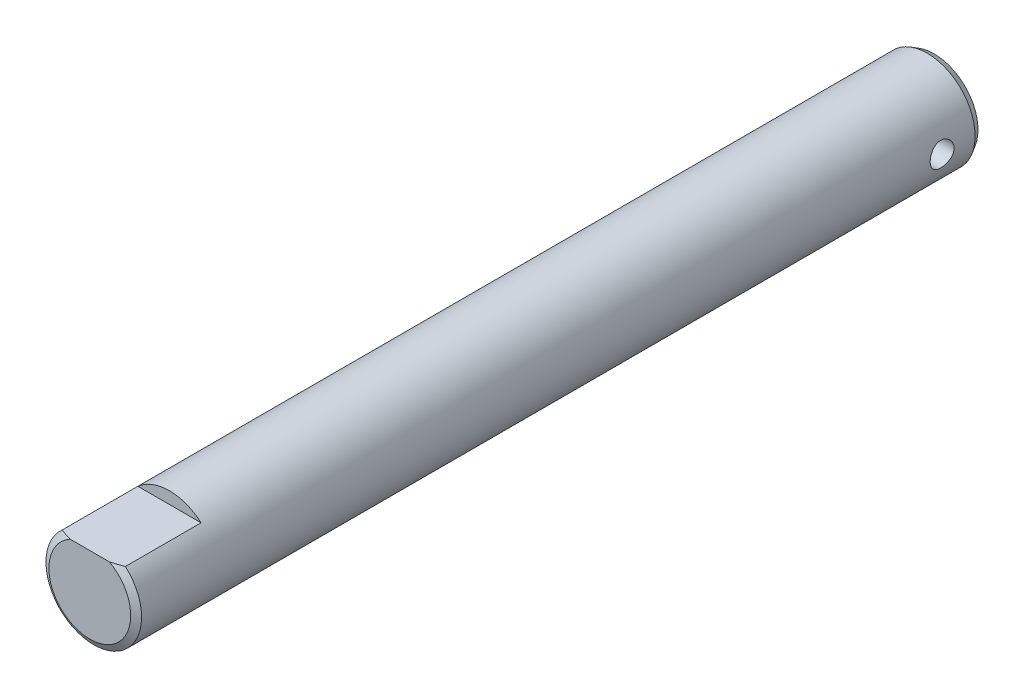
from build123d import *
from OCP.BRepFilletAPI import BRepFilletAPI_MakeChamfer

# Parameters (mm, degrees)
SKETCH1_R               = 6
BOSS_EXTRUDE1_DEPTH     = 106
SKETCH2_W               = 13.379155745
SKETCH2_H               = 3.606315643
CUT_EXTRUDE1_DEPTH      = 10
CUT_EXTRUDE2_DEPTH      = 107.339080304
CUT_EXTRUDE2_DEPTH_BACK = 107.339080304
SKETCH3_R               = 1.5
CHAMFER1_SIZE           = 0.5
CHAMFER1_SIZE2          = 0.866025404


with BuildPart() as part:
    # Sketch1 → Boss-Extrude1 (new body)
    with BuildSketch(Plane.XY):
        Circle(SKETCH1_R)
    extrude(amount=BOSS_EXTRUDE1_DEPTH)

    # Sketch2 → Cut-Extrude1 (cut)
    with BuildSketch(Plane.XY.offset(106)):
        with Locations((0.240832393, 6.303157822)):
            Rectangle(SKETCH2_W, SKETCH2_H)
    extrude(amount=-CUT_EXTRUDE1_DEPTH, mode=Mode.SUBTRACT)

    # Sketch3 → Cut-Extrude2 (cut, two sides: drawn at the far end of the back side and taken through both)
    with BuildSketch(Plane(origin=(0, 0, 0), x_dir=(0, 0, -1), z_dir=(1, 0, 0)).offset(-CUT_EXTRUDE2_DEPTH_BACK)):
        with Locations((-5, 0)):
            Circle(SKETCH3_R)
    extrude(amount=CUT_EXTRUDE2_DEPTH + CUT_EXTRUDE2_DEPTH_BACK, mode=Mode.SUBTRACT)

    # Chamfer1: one chamfer whose edges measure the first distance from different faces: ONE call of the kernel's chamfer builder (chamfer() names one face for all edges)
    chamfer1_edges_1 = [part.edges().sort_by_distance(p)[0] for p in [
        (-6, 0, 0),
    ]]
    chamfer1_side_1 = [part.faces().sort_by_distance(p)[0] for p in [
        (0, 0, 0),
    ]]
    chamfer1_edges_2 = [part.edges().sort_by_distance(p)[0] for p in [
        (-2.468626967, -5.468626967, 106),
    ]]
    chamfer1_side_2 = [part.faces().sort_by_distance(p)[0] for p in [
        (-6, 0, 53),
    ]]
    chamfer1 = BRepFilletAPI_MakeChamfer(part.part.solid().wrapped)
    for e in chamfer1_edges_1:
        chamfer1.Add(CHAMFER1_SIZE, CHAMFER1_SIZE2, e.wrapped, chamfer1_side_1[0].wrapped)  # the first distance lies on this face
    for e in chamfer1_edges_2:
        chamfer1.Add(CHAMFER1_SIZE, CHAMFER1_SIZE2, e.wrapped, chamfer1_side_2[0].wrapped)  # the first distance lies on this face
    add(Compound.cast(chamfer1.Shape()), mode=Mode.REPLACE)


solid = part.part
